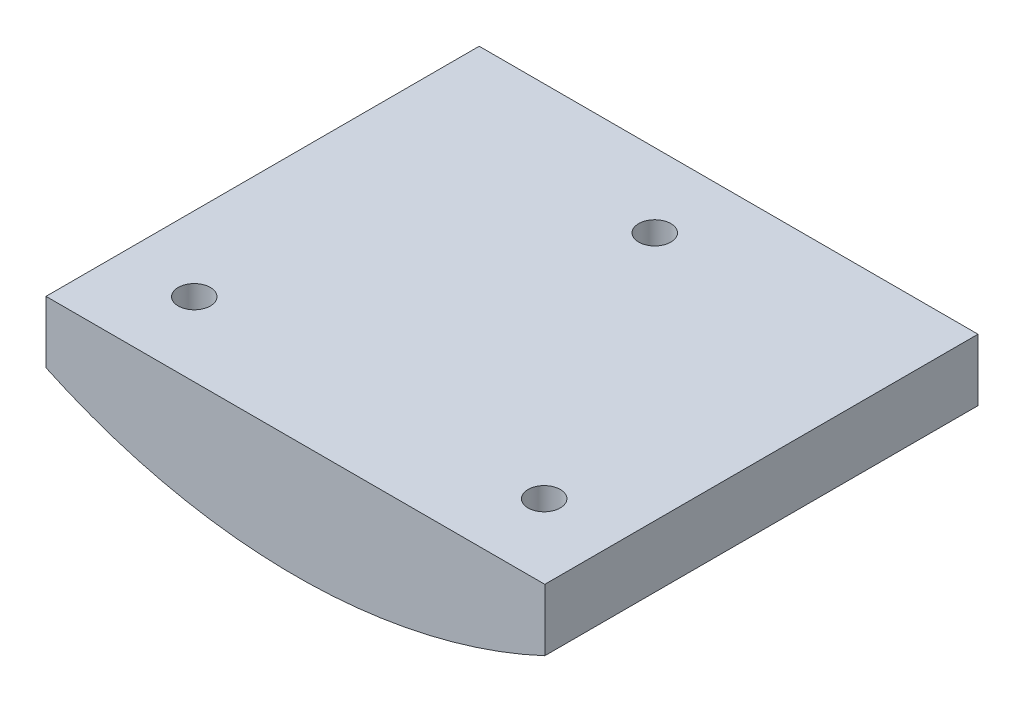
from build123d import *

# Parameters (mm, degrees)
SKETCH1_W             = 51.181
SKETCH1_H             = 44.45
BOSS_EXTRUDE1_DEPTH   = 6.35
BOSS_EXTRUDE2_DEPTH   = 44.45
M4X0_7_TAPPED_HOLE1_D = 3.3


with BuildPart() as part:
    # Sketch1 → Boss-Extrude1 (new body)
    with BuildSketch(Plane(origin=(0, 0, 0), x_dir=(1, 0, 0), z_dir=(0, 1, 0))):
        Rectangle(SKETCH1_W, SKETCH1_H)
    extrude(amount=BOSS_EXTRUDE1_DEPTH)

    # Sketch2 → Boss-Extrude2 (add)
    with BuildSketch(Plane.XY.offset(22.225)):
        with BuildLine():
            Line((-25.5905, 0), (25.5905, 0))
            ThreePointArc((25.5905, 0), (0, -5.696875973), (-25.5905, 0))
        make_face()
    extrude(amount=-BOSS_EXTRUDE2_DEPTH)

    # M4x0.7 Tapped Hole1 (through all)
    with Locations(Plane(origin=(0, 6.35, 0), x_dir=(1, 0, 0), z_dir=(0, 1, 0))):
        with Locations((0, 14.65), (-17.950000041, -14.65), (17.950000041, -14.65)):
            Hole(M4X0_7_TAPPED_HOLE1_D / 2)


solid = part.part
